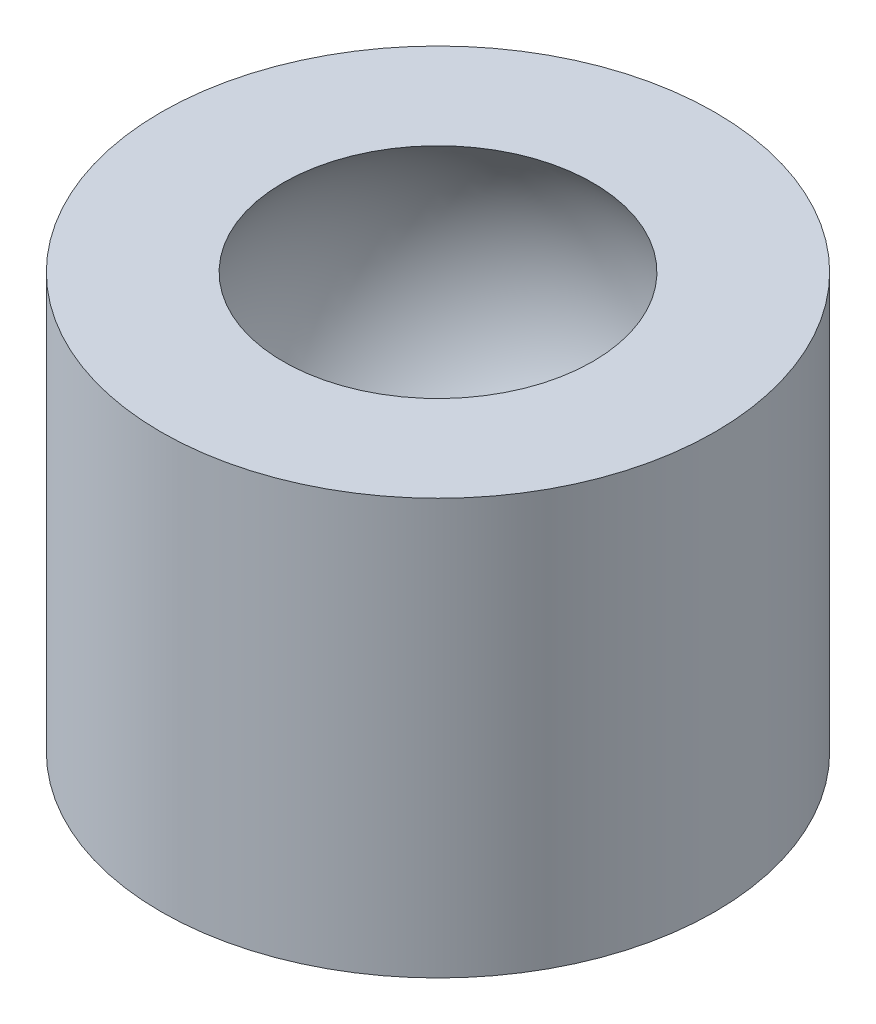
from build123d import *


with BuildPart() as part:
    # Szkic1 → Obrót1 (revolve)
    with BuildSketch(Plane.XY):
        with BuildLine():
            Line((-20, 0), (0, 0))
            Line((0, 0), (0, 5))
            ThreePointArc((0, 5), (-13.693063938, 13.876275643), (-11.180339887, 30))
            Line((-11.180339887, 30), (-20, 30))
            Line((-20, 30), (-20, 0))
        make_face()
    revolve(axis=Axis((0, 0, 0), (0, 1, 0)))


solid = part.part
